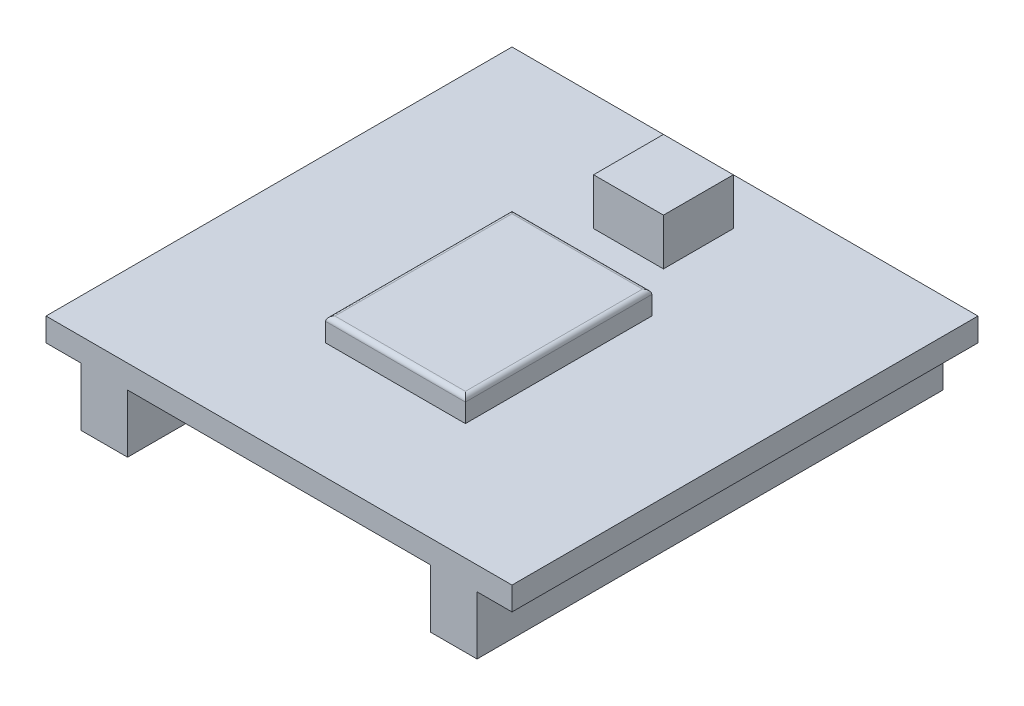
from build123d import *

# Parameters (mm, degrees)
CROQUIS1_W              = 20
CROQUIS1_H              = 20
SALIENTE_EXTRUIR1_DEPTH = 1
CROQUIS2_W              = 6
CROQUIS2_H              = 8
SALIENTE_EXTRUIR2_DEPTH = 1
REDONDEO1_R             = 0.2
CROQUIS3_W              = 3
CROQUIS3_H              = 3
SALIENTE_EXTRUIR3_DEPTH = 2
CROQUIS4_W              = 2
CROQUIS4_H              = 20
SALIENTE_EXTRUIR4_DEPTH = 2.5


with BuildPart() as part:
    # Croquis1 → Saliente-Extruir1 (new body)
    with BuildSketch(Plane(origin=(0, 0, 0), x_dir=(1, 0, 0), z_dir=(0, 1, 0))):
        Rectangle(CROQUIS1_W, CROQUIS1_H)
    extrude(amount=SALIENTE_EXTRUIR1_DEPTH)

    # Croquis2 → Saliente-Extruir2 (add)
    with BuildSketch(Plane(origin=(0, 1, 0), x_dir=(1, 0, 0), z_dir=(0, 1, 0))):
        with Locations((0, -1)):
            Rectangle(CROQUIS2_W, CROQUIS2_H)
    extrude(amount=SALIENTE_EXTRUIR2_DEPTH)

    # Redondeo1
    redondeo1_edges = [part.edges().sort_by_distance(p)[0] for p in [
        (3, 2, 1),
        (0, 2, -3),
        (-3, 2, 1),
        (0, 2, 5),
    ]]
    fillet(redondeo1_edges, radius=REDONDEO1_R)

    # Croquis3 → Saliente-Extruir3 (add)
    with BuildSketch(Plane(origin=(0, 1, 0), x_dir=(1, 0, 0), z_dir=(0, 1, 0))):
        with Locations((0, 6.5)):
            Rectangle(CROQUIS3_W, CROQUIS3_H)
    extrude(amount=SALIENTE_EXTRUIR3_DEPTH)

    # Croquis4 → Saliente-Extruir4 (add)
    with BuildSketch(Plane.XZ):
        with Locations((-7.5, 0)):
            Rectangle(CROQUIS4_W, CROQUIS4_H)
        with Locations((7.5, 0)):
            Rectangle(CROQUIS4_W, CROQUIS4_H)
    extrude(amount=SALIENTE_EXTRUIR4_DEPTH)


solid = part.part
